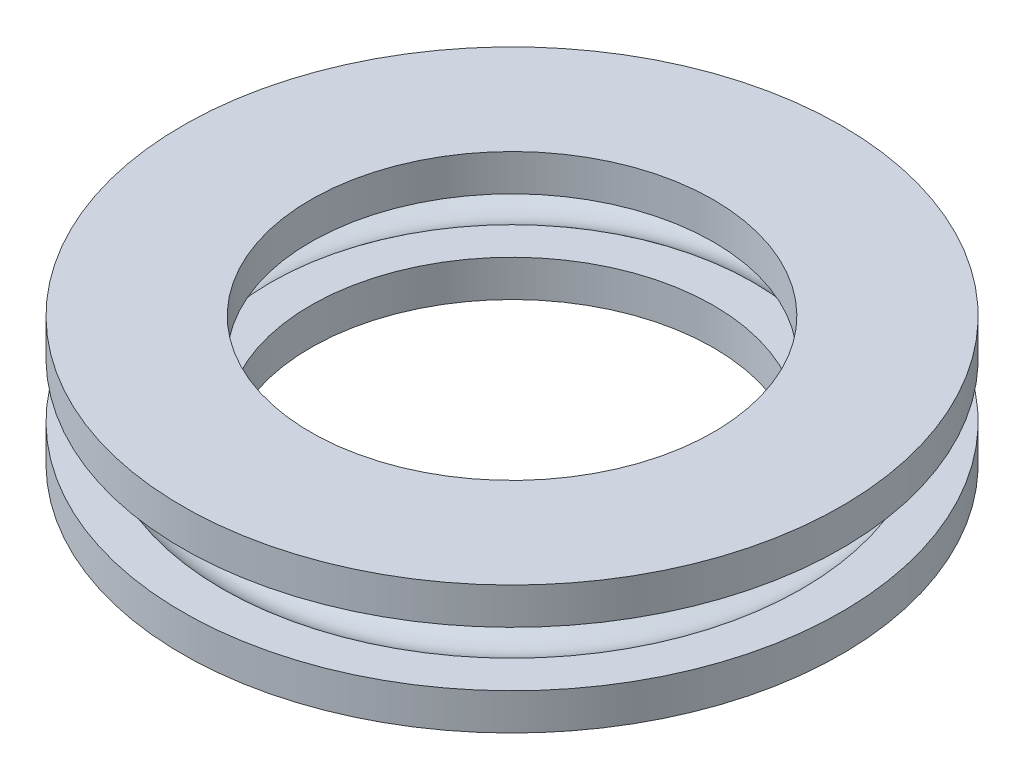
from build123d import *


with BuildPart() as part:
    # Sketch1 → Revolve1 (revolve)
    with BuildSketch(Plane.YZ):
        with BuildLine():
            Line((-8.75, -27.5), (-3.75, -27.5))
            Line((-3.75, -27.5), (-3.75, -32.942810861))
            ThreePointArc((-3.75, -32.942810861), (-5, -36.25), (-3.75, -39.557189139))
            Line((-3.75, -39.557189139), (-3.75, -45))
            Line((-3.75, -45), (-8.75, -45))
            Line((-8.75, -45), (-8.75, -27.5))
        make_face()
        with BuildLine():
            Line((3.75, -39.557189139), (3.75, -45))
            Line((3.75, -45), (8.75, -45))
            Line((8.75, -45), (8.75, -27.5))
            Line((8.75, -27.5), (3.75, -27.5))
            Line((3.75, -27.5), (3.75, -32.942810861))
            ThreePointArc((3.75, -32.942810861), (5, -36.25), (3.75, -39.557189139))
        make_face()
    revolve(axis=Axis((0, -72.777596874, 0), (0, 1, 0)))


solid = part.part
